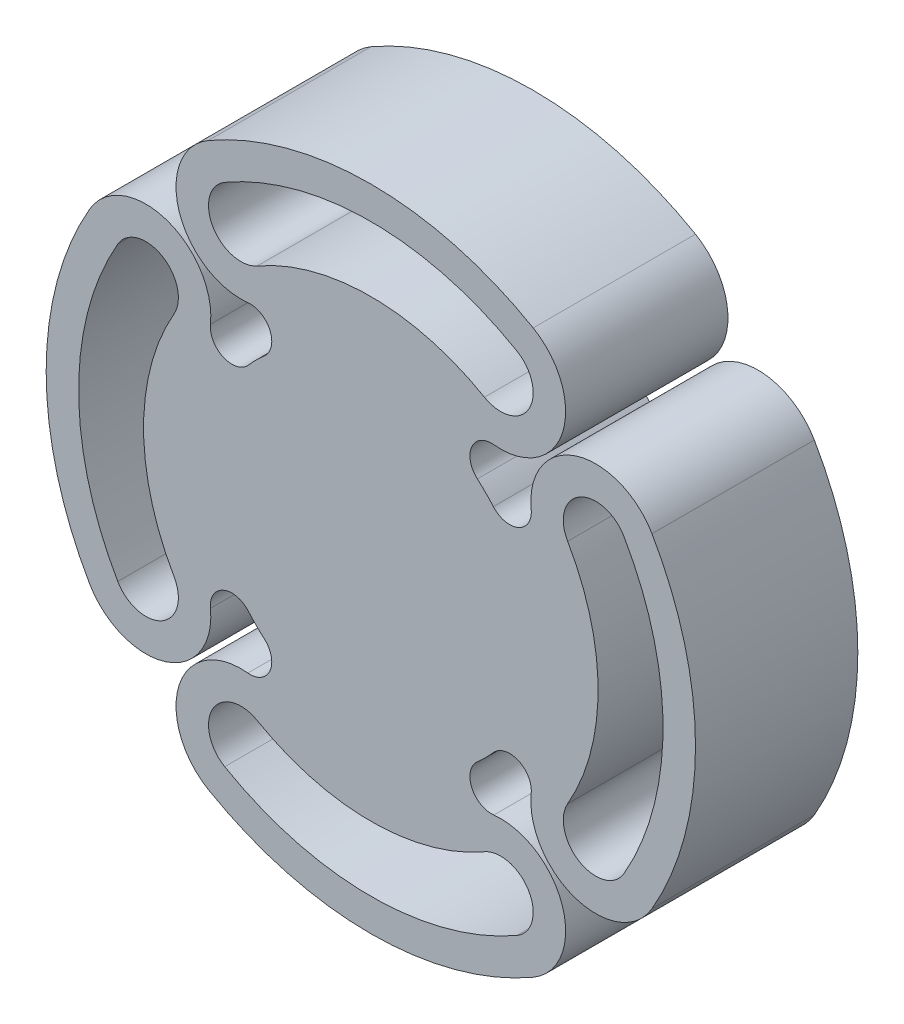
from build123d import *

# Parameters (mm, degrees)
BOSS_EXTRUDE1_DEPTH = 7.5


with BuildPart() as part:
    # Sketch1 → Boss-Extrude1 (new, symmetric)
    with BuildSketch(Plane.XY):
        with BuildLine():
            ThreePointArc((11.320151918, 9.841451141), (10.606601718, 10.606601718), (9.841451141, 11.320151918))
            ThreePointArc((9.841451141, 11.320151918), (9.32005242, 13.628216731), (11.36523347, 14.818281553))
            ThreePointArc((11.36523347, 14.818281553), (17.70515779, 18.926875967), (15, 25.980762114))
            ThreePointArc((15, 25.980762114), (0, 30), (-15, 25.980762114))
            ThreePointArc((-15, 25.980762114), (-17.70515779, 18.926875967), (-11.36523347, 14.818281553))
            ThreePointArc((-11.36523347, 14.818281553), (-9.32005242, 13.628216731), (-9.841451141, 11.320151918))
            ThreePointArc((-9.841451141, 11.320151918), (-10.606601718, 10.606601718), (-11.320151918, 9.841451141))
            ThreePointArc((-11.320151918, 9.841451141), (-13.628216731, 9.32005242), (-14.818281553, 11.36523347))
            ThreePointArc((-14.818281553, 11.36523347), (-18.926875967, 17.70515779), (-25.980762114, 15))
            ThreePointArc((-25.980762114, 15), (-30, 0), (-25.980762114, -15))
            ThreePointArc((-25.980762114, -15), (-18.926875967, -17.70515779), (-14.818281553, -11.36523347))
            ThreePointArc((-14.818281553, -11.36523347), (-13.628216731, -9.32005242), (-11.320151918, -9.841451141))
            ThreePointArc((-11.320151918, -9.841451141), (-10.606601718, -10.606601718), (-9.841451141, -11.320151918))
            ThreePointArc((-9.841451141, -11.320151918), (-9.32005242, -13.628216731), (-11.36523347, -14.818281553))
            ThreePointArc((-11.36523347, -14.818281553), (-17.70515779, -18.926875967), (-15, -25.980762114))
            ThreePointArc((-15, -25.980762114), (0, -30), (15, -25.980762114))
            ThreePointArc((15, -25.980762114), (17.70515779, -18.926875967), (11.36523347, -14.818281553))
            ThreePointArc((11.36523347, -14.818281553), (9.32005242, -13.628216731), (9.841451141, -11.320151918))
            ThreePointArc((9.841451141, -11.320151918), (10.606601718, -10.606601718), (11.320151918, -9.841451141))
            ThreePointArc((11.320151918, -9.841451141), (13.628216731, -9.32005242), (14.818281553, -11.36523347))
            ThreePointArc((14.818281553, -11.36523347), (18.926875967, -17.70515779), (25.980762114, -15))
            ThreePointArc((25.980762114, -15), (30, 0), (25.980762114, 15))
            ThreePointArc((25.980762114, 15), (18.926875967, 17.70515779), (14.818281553, 11.36523347))
            ThreePointArc((14.818281553, 11.36523347), (13.628216731, 9.32005242), (11.320151918, 9.841451141))
        make_face()
        with BuildLine():
            ThreePointArc((23.382685902, -13.5), (27, 0), (23.382685902, 13.5))
            ThreePointArc((23.382685902, 13.5), (19.284609691, 14.598076211), (18.186533479, 10.5))
            ThreePointArc((18.186533479, 10.5), (21, 0), (18.186533479, -10.5))
            ThreePointArc((18.186533479, -10.5), (19.284609691, -14.598076211), (23.382685902, -13.5))
        make_face(mode=Mode.SUBTRACT)
        with BuildLine():
            ThreePointArc((-10.5, -18.186533479), (0, -21), (10.5, -18.186533479))
            ThreePointArc((10.5, -18.186533479), (14.598076211, -19.284609691), (13.5, -23.382685902))
            ThreePointArc((13.5, -23.382685902), (0, -27), (-13.5, -23.382685902))
            ThreePointArc((-13.5, -23.382685902), (-14.598076211, -19.284609691), (-10.5, -18.186533479))
        make_face(mode=Mode.SUBTRACT)
        with BuildLine():
            ThreePointArc((-18.186533479, 10.5), (-21, 0), (-18.186533479, -10.5))
            ThreePointArc((-18.186533479, -10.5), (-19.284609691, -14.598076211), (-23.382685902, -13.5))
            ThreePointArc((-23.382685902, -13.5), (-27, 0), (-23.382685902, 13.5))
            ThreePointArc((-23.382685902, 13.5), (-19.284609691, 14.598076211), (-18.186533479, 10.5))
        make_face(mode=Mode.SUBTRACT)
        with BuildLine():
            ThreePointArc((10.5, 18.186533479), (0, 21), (-10.5, 18.186533479))
            ThreePointArc((-10.5, 18.186533479), (-14.598076211, 19.284609691), (-13.5, 23.382685902))
            ThreePointArc((-13.5, 23.382685902), (0, 27), (13.5, 23.382685902))
            ThreePointArc((13.5, 23.382685902), (14.598076211, 19.284609691), (10.5, 18.186533479))
        make_face(mode=Mode.SUBTRACT)
    extrude(amount=BOSS_EXTRUDE1_DEPTH, both=True)


solid = part.part
